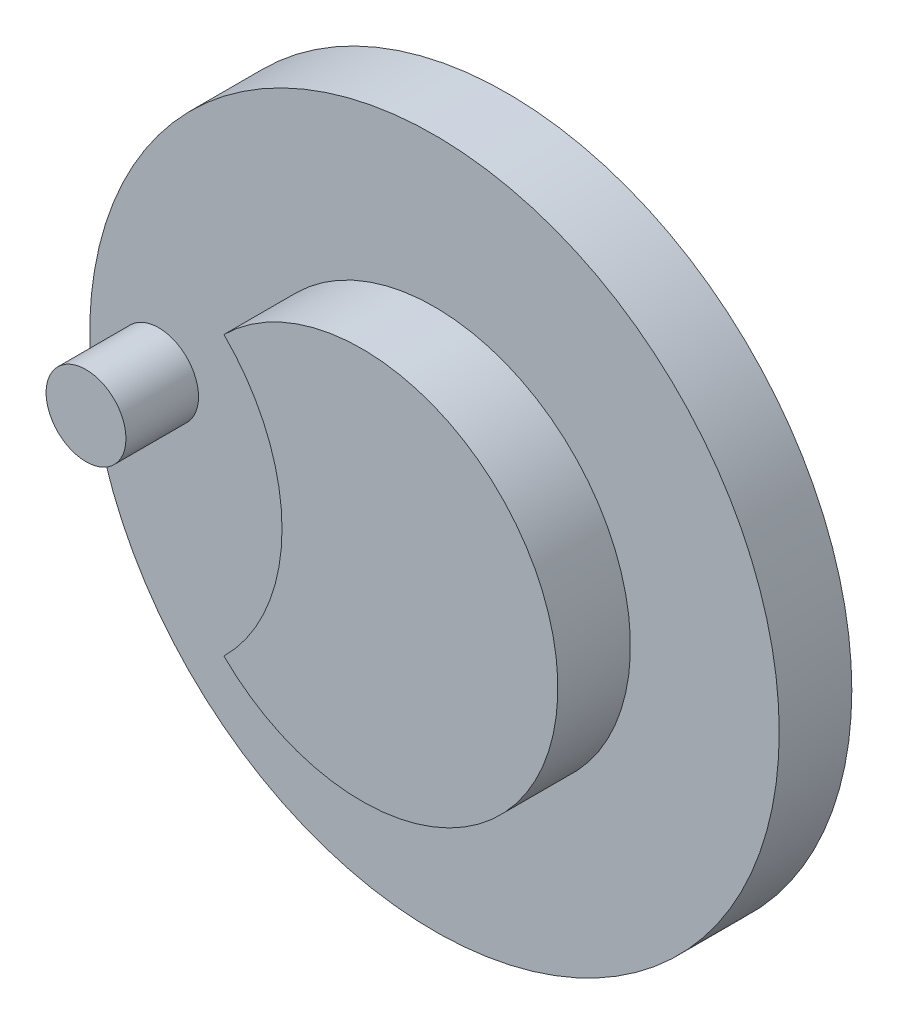
from build123d import *

# Parameters (mm, degrees)
CROQUIS2_R              = 47.5
CROQUIS2_R_2            = 5.5
SALIENTE_EXTRUIR1_DEPTH = 10
CROQUIS2_4_R            = 5.5
SALIENTE_EXTRUIR2_DEPTH = 20
CROQUIS6_R              = 5
SALIENTE_EXTRUIR3_DEPTH = 10


with BuildPart() as part:
    # Croquis2 → Saliente-Extruir1 (new body)
    with BuildSketch(Plane.XY):
        Circle(CROQUIS2_R)
        with Locations((-38, 0)):
            Circle(CROQUIS2_R_2, mode=Mode.SUBTRACT)
        with BuildLine():
            ThreePointArc((-19, 19.183326093), (27, 0), (-19, -19.183326093))
            ThreePointArc((-19, -19.183326093), (-11, 0), (-19, 19.183326093))
        make_face(mode=Mode.SUBTRACT)
    extrude(amount=SALIENTE_EXTRUIR1_DEPTH)

    # Croquis2<4> → Saliente-Extruir2 (add)
    with BuildSketch(Plane.XY):
        with BuildLine():
            ThreePointArc((-19, 19.183326093), (-11, 0), (-19, -19.183326093))
            ThreePointArc((-19, -19.183326093), (27, 0), (-19, 19.183326093))
        make_face()
        with Locations((-38, 0)):
            Circle(CROQUIS2_4_R)
    extrude(amount=SALIENTE_EXTRUIR2_DEPTH)

    # Croquis6 → Saliente-Extruir3 (add)
    with BuildSketch(Plane(origin=(0, 0, 0), x_dir=(-1, 0, 0), z_dir=(0, 0, -1))):
        Circle(CROQUIS6_R)
    extrude(amount=SALIENTE_EXTRUIR3_DEPTH)


solid = part.part
